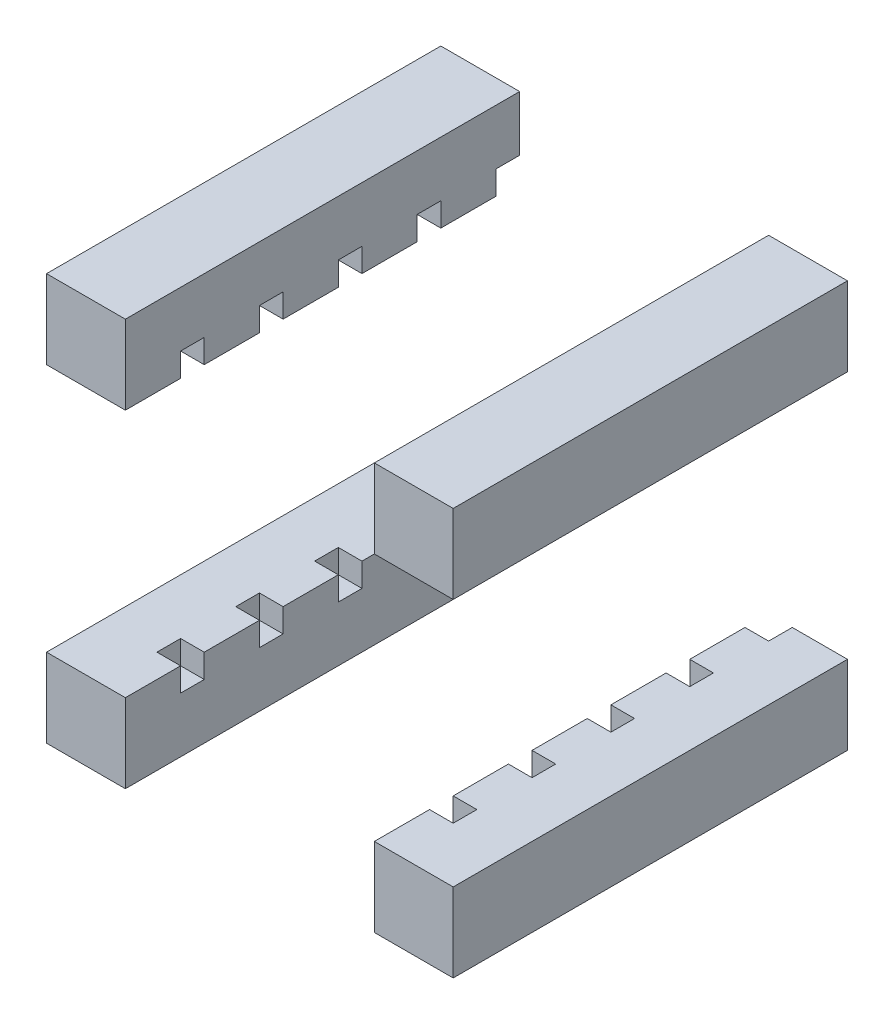
from build123d import *

# Parameters (mm, degrees)
ESQUISSE1_W                = 51.57
ESQUISSE1_H                = 51.57
BOSS_EXTRU_1_DEPTH         = 50
ENL_V_MAT_EXTRU_1_DEPTH    = 50
ESQUISSE3_W                = 37.57
ESQUISSE3_H                = 37.57
ENL_V_MAT_EXTRU_2_DEPTH    = 3
R_P_TITION_LIN_AIRE1_COUNT = 13
R_P_TITION_LIN_AIRE1_PITCH = 10


with BuildPart() as part:
    # Esquisse1 → Boss.-Extru.1 (new body)
    with BuildSketch(Plane.XY):
        Rectangle(ESQUISSE1_W, ESQUISSE1_H)
    extrude(amount=BOSS_EXTRU_1_DEPTH)

    # Esquisse2 → Enlèv. mat.-Extru.1 (cut)
    with BuildSketch(Plane.XY.offset(50)):
        Polygon((-25.785, 15.785), (-15.785, 15.785), (-15.785, 25.785), (15.785, 25.785), (15.785, 15.785), (25.785, 15.785), (25.785, -15.785), (15.785, -15.785), (15.785, -25.785), (-15.785, -25.785), (-15.785, -15.785), (-25.785, -15.785), align=None)
    extrude(amount=-ENL_V_MAT_EXTRU_1_DEPTH, mode=Mode.SUBTRACT)


with BuildPart() as enl_v_mat_extru_1_piece_1:
    # of the separate pieces the step leaves, piece 1, a body of its own (enl_v_mat_extru_1_pieces)
    add(part.part.solids().sort_by_distance((-25.785, 25.785, 0))[0])


with BuildPart() as enl_v_mat_extru_1_piece_2:
    # of the separate pieces the step leaves, piece 2, a body of its own (enl_v_mat_extru_1_pieces)
    add(part.part.solids().sort_by_distance((25.785, -15.785, 0))[0])


with BuildPart() as enl_v_mat_extru_1_piece_3:
    # of the separate pieces the step leaves, piece 3, a body of its own (enl_v_mat_extru_1_pieces)
    add(part.part.solids().sort_by_distance((-25.785, -25.785, 0))[0])


with BuildPart() as enl_v_mat_extru_1_piece_4:
    # of the separate pieces the step leaves, piece 4, a body of its own (enl_v_mat_extru_1_pieces)
    add(part.part.solids().sort_by_distance((15.785, 25.785, 0))[0])


with BuildPart() as enl_v_mat_extru_2_tool:
    # Esquisse3 → Enlèv. mat.-Extru.2 (new body)
    with BuildSketch(Plane(origin=(0, 0, 0), x_dir=(-1, 0, 0), z_dir=(0, 0, -1))):
        Rectangle(ESQUISSE3_W, ESQUISSE3_H)
    enl_v_mat_extru_2 = extrude(amount=-ENL_V_MAT_EXTRU_2_DEPTH)


with BuildPart() as enl_v_mat_extru_1_piece_1_1:
    add(enl_v_mat_extru_1_piece_1.part)

    # Enlèv. mat.-Extru.2: cut by enl_v_mat_extru_2_tool
    add(enl_v_mat_extru_2_tool.part, mode=Mode.SUBTRACT)


with BuildPart() as enl_v_mat_extru_1_piece_2_1:
    add(enl_v_mat_extru_1_piece_2.part)

    # Enlèv. mat.-Extru.2: cut by enl_v_mat_extru_2_tool
    add(enl_v_mat_extru_2_tool.part, mode=Mode.SUBTRACT)


with BuildPart() as enl_v_mat_extru_1_piece_3_1:
    add(enl_v_mat_extru_1_piece_3.part)

    # Enlèv. mat.-Extru.2: cut by enl_v_mat_extru_2_tool
    add(enl_v_mat_extru_2_tool.part, mode=Mode.SUBTRACT)


with BuildPart() as enl_v_mat_extru_1_piece_4_1:
    add(enl_v_mat_extru_1_piece_4.part)

    # Enlèv. mat.-Extru.2: cut by enl_v_mat_extru_2_tool
    add(enl_v_mat_extru_2_tool.part, mode=Mode.SUBTRACT)


with BuildPart() as r_p_tition_lin_aire1_tool:
    # Répétition linéaire1: Enlèv. mat.-Extru.2 ×13
    with Locations(*[(0, 0, i * R_P_TITION_LIN_AIRE1_PITCH) for i in range(1, R_P_TITION_LIN_AIRE1_COUNT)]):
        add(enl_v_mat_extru_2)


with BuildPart() as enl_v_mat_extru_1_piece_1_2:
    add(enl_v_mat_extru_1_piece_1_1.part)

    # Répétition linéaire1: cut by r_p_tition_lin_aire1_tool
    add(r_p_tition_lin_aire1_tool.part, mode=Mode.SUBTRACT)


with BuildPart() as enl_v_mat_extru_1_piece_2_2:
    add(enl_v_mat_extru_1_piece_2_1.part)

    # Répétition linéaire1: cut by r_p_tition_lin_aire1_tool
    add(r_p_tition_lin_aire1_tool.part, mode=Mode.SUBTRACT)


with BuildPart() as enl_v_mat_extru_1_piece_3_2:
    add(enl_v_mat_extru_1_piece_3_1.part)

    # Répétition linéaire1: cut by r_p_tition_lin_aire1_tool
    add(r_p_tition_lin_aire1_tool.part, mode=Mode.SUBTRACT)


with BuildPart() as enl_v_mat_extru_1_piece_4_2:
    add(enl_v_mat_extru_1_piece_4_1.part)

    # Répétition linéaire1: cut by r_p_tition_lin_aire1_tool
    add(r_p_tition_lin_aire1_tool.part, mode=Mode.SUBTRACT)


solid = Compound([enl_v_mat_extru_1_piece_1_2.part, enl_v_mat_extru_1_piece_2_2.part, enl_v_mat_extru_1_piece_3_2.part, enl_v_mat_extru_1_piece_4_2.part])
